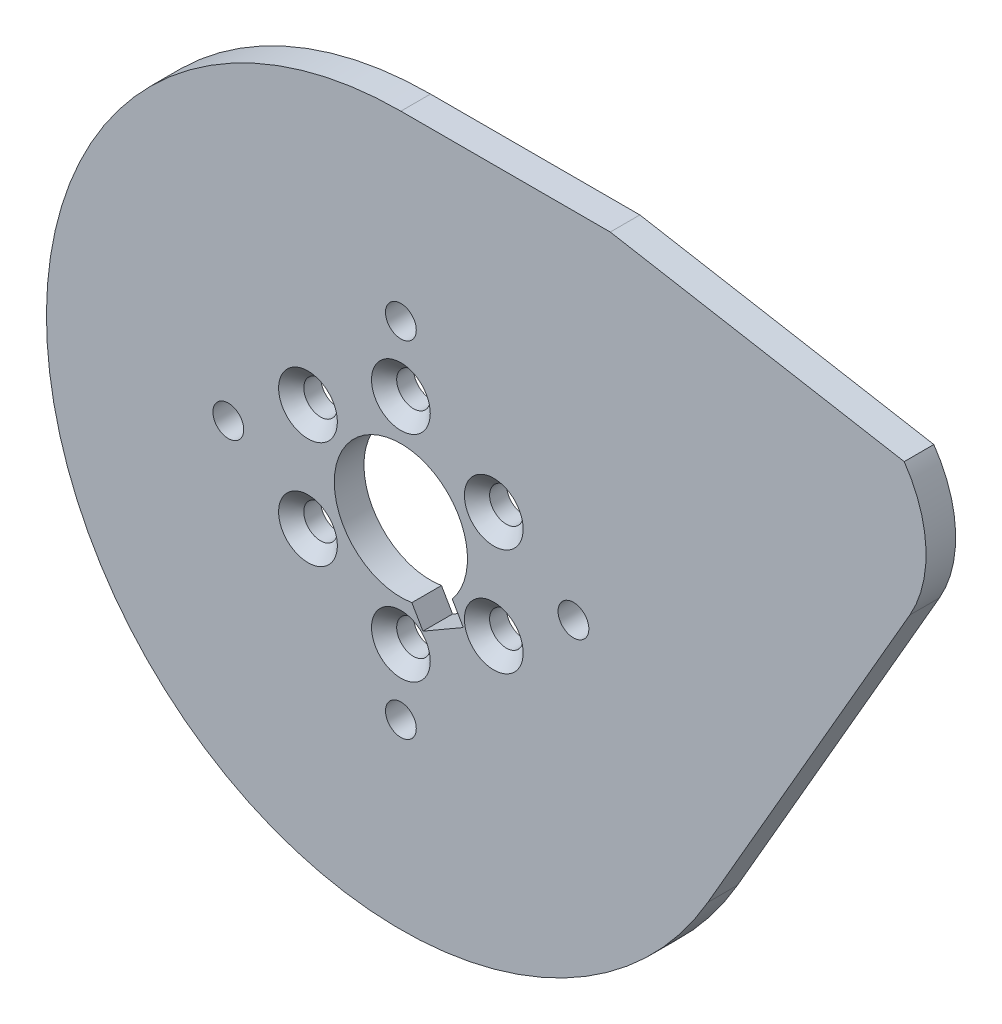
from build123d import *

# Parameters (mm, degrees)
BOSS_EXTRUDE1_DEPTH                             = 3.175
CUT_EXTRUDE1_DEPTH                              = 68.99936507
SKETCH3_W                                       = 7.1374
SKETCH3_H                                       = 3.175
M4X0_7_TAPPED_HOLE1_D                           = 3.3
CSK_FOR_M3_FLAT_HEAD_MACHINE_SCREW1_D           = 3.6
CSK_FOR_M3_FLAT_HEAD_MACHINE_SCREW1_CSINK_D     = 6.3
CSK_FOR_M3_FLAT_HEAD_MACHINE_SCREW1_CSINK_ANGLE = 90


with BuildPart() as part:
    # Sketch1 → Boss-Extrude1 (new body)
    with BuildSketch(Plane.XY.offset(3.175)):
        with BuildLine():
            Line((53.959502015, 32.443258315), (22.445653919, 38))
            Line((22.445653919, 38), (0, 38))
            ThreePointArc((0, 38), (-32.908965344, -19), (32.908965344, -19))
            Line((32.908965344, -19), (54.559600438, 18.5))
            ThreePointArc((54.559600438, 18.5), (56.289246799, 25.558984429), (53.959502015, 32.443258315))
        make_face()
    extrude(amount=-BOSS_EXTRUDE1_DEPTH)

    # Sketch2 → Cut-Extrude1 (cut, through all)
    with BuildSketch(Plane(origin=(0, 0, 0), x_dir=(-1, 0, 0), z_dir=(0, 0, -1))):
        with BuildLine():
            Line((-6.694313457, -6.59489103), (-2.364186438, -9.09489103))
            Line((-2.364186438, -9.09489103), (-1.17755817, -7.039590579))
            ThreePointArc((-1.17755817, -7.039590579), (-3.5687, -6.181169717), (-5.507685189, -4.539590579))
            Line((-5.507685189, -4.539590579), (-6.694313457, -6.59489103))
        make_face()
    extrude(amount=-CUT_EXTRUDE1_DEPTH, mode=Mode.SUBTRACT)

    # Sketch3 → Cut-Revolve1 (revolve, cut)
    with BuildSketch(Plane.XZ):
        with Locations((3.5687, 1.5875)):
            Rectangle(SKETCH3_W, SKETCH3_H)
    revolve(axis=Axis((0, 0, 3.175), (0, 0, -1)), mode=Mode.SUBTRACT)

    # M4x0.7 Tapped Hole1 (through all)
    with Locations(Plane.XY.offset(3.175)):
        with Locations((18.5, 0), (0, -18.5), (-18.5, 0), (0, 18.5)):
            Hole(M4X0_7_TAPPED_HOLE1_D / 2)

    # CSK for M3 Flat Head Machine Screw1 (through all)
    with Locations(Plane.XY.offset(3.175)):
        with Locations((-9.959292144, 5.75), (-9.959292144, -5.75), (0, -11.5), (9.959292144, -5.75), (9.959292144, 5.75), (0, 11.5)):
            CounterSinkHole(CSK_FOR_M3_FLAT_HEAD_MACHINE_SCREW1_D / 2, CSK_FOR_M3_FLAT_HEAD_MACHINE_SCREW1_CSINK_D / 2, counter_sink_angle=CSK_FOR_M3_FLAT_HEAD_MACHINE_SCREW1_CSINK_ANGLE)


solid = part.part
